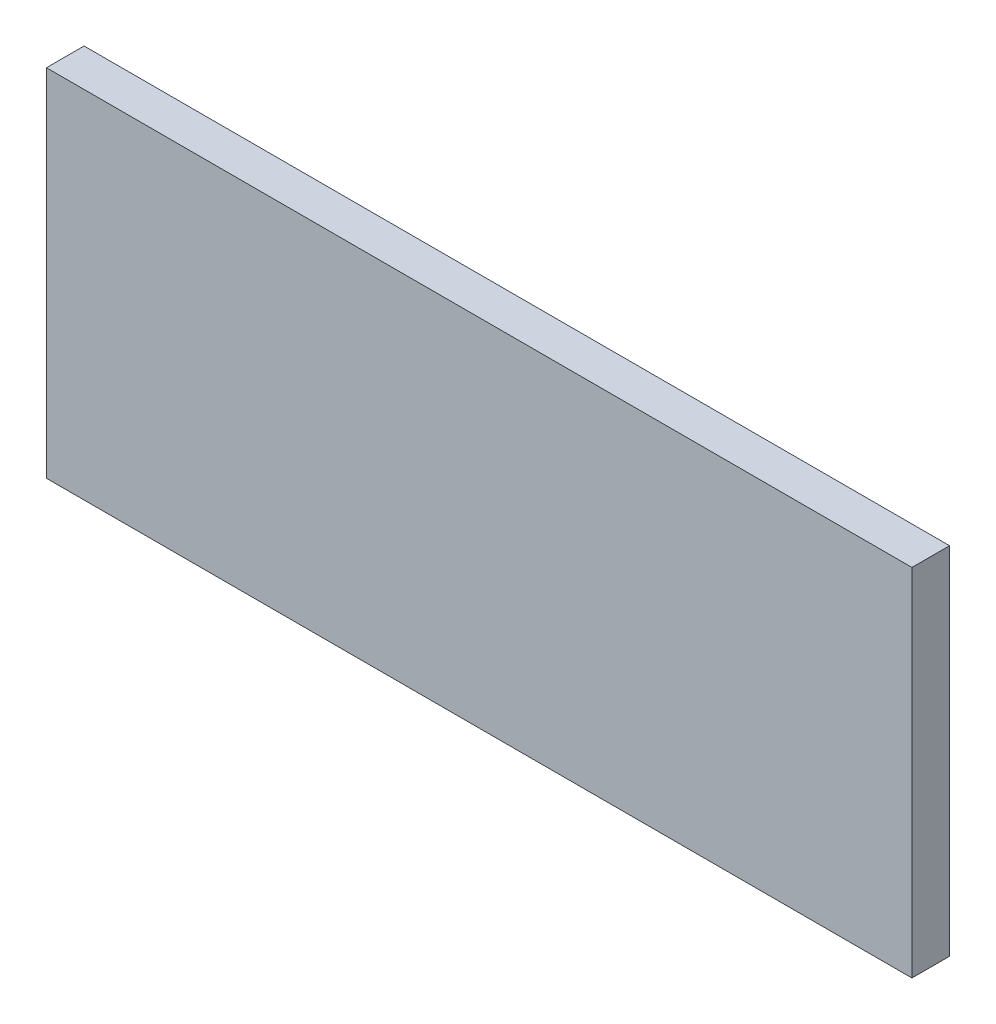
from build123d import *

# Parameters (mm, degrees)
SKETCH1_W           = 292.1
SKETCH1_H           = 120
BOSS_EXTRUDE1_DEPTH = 12.7


with BuildPart() as part:
    # Sketch1 → Boss-Extrude1 (new body)
    with BuildSketch(Plane.XY):
        Rectangle(SKETCH1_W, SKETCH1_H)
    extrude(amount=BOSS_EXTRUDE1_DEPTH)


solid = part.part
